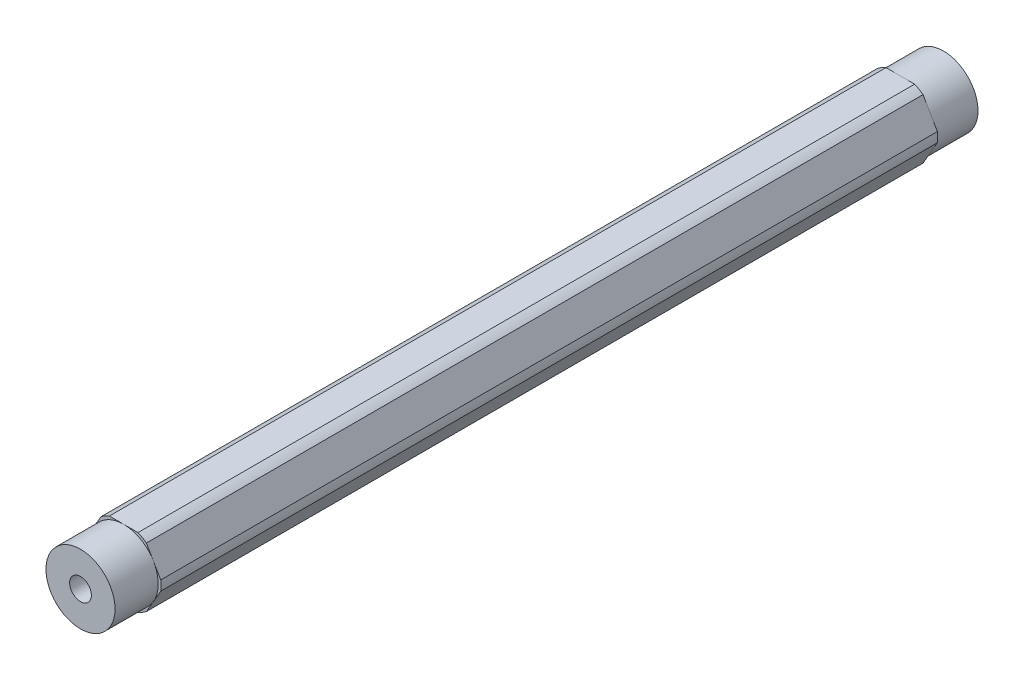
from build123d import *

# Parameters (mm, degrees)
SKETCH1_R           = 2.000000064
BOSS_EXTRUDE1_DEPTH = 71.4121
SKETCH4_R           = 6.35
SKETCH4_R_2         = 2.000000064
BOSS_EXTRUDE2_DEPTH = 7.9375


with BuildPart() as part:
    # Sketch1 → Boss-Extrude1 (new, symmetric)
    with BuildSketch(Plane.XY):
        with BuildLine():
            ThreePointArc((4.181770846, 5.456960429), (3.437499983, 5.953924622), (2.634980936, 6.35))
            Line((2.634980936, 6.35), (-2.634980936, 6.35))
            ThreePointArc((-2.634980936, 6.35), (-3.437499983, 5.953924622), (-4.181770846, 5.456960429))
            Line((-4.181770846, 5.456960429), (-6.816751782, 0.893039571))
            ThreePointArc((-6.816751782, 0.893039571), (-6.874999966, 0), (-6.816751782, -0.893039571))
            Line((-6.816751782, -0.893039571), (-4.181770846, -5.456960429))
            ThreePointArc((-4.181770846, -5.456960429), (-3.437499983, -5.953924622), (-2.634980936, -6.35))
            Line((-2.634980936, -6.35), (2.634980936, -6.35))
            ThreePointArc((2.634980936, -6.35), (3.437499983, -5.953924622), (4.181770846, -5.456960429))
            Line((4.181770846, -5.456960429), (6.816751782, -0.893039571))
            ThreePointArc((6.816751782, -0.893039571), (6.860422465, -0.447468582), (6.874999966, 0))
            ThreePointArc((6.874999966, 0), (6.860422465, 0.447468582), (6.816751782, 0.893039571))
            Line((6.816751782, 0.893039571), (4.181770846, 5.456960429))
        make_face()
        Circle(SKETCH1_R, mode=Mode.SUBTRACT)
    extrude(amount=BOSS_EXTRUDE1_DEPTH, both=True)

    # Sketch4 → Boss-Extrude2 (add)
    with BuildSketch(Plane.XY.offset(71.4121)):
        with Locations(Location((0, 0, 0), (0, 0, 150))):
            Circle(SKETCH4_R)
        Circle(SKETCH4_R_2, mode=Mode.SUBTRACT)
    boss_extrude2 = extrude(amount=BOSS_EXTRUDE2_DEPTH)

    # Mirror1: Boss-Extrude2 across plane
    add(boss_extrude2.mirror(Plane.XY))


solid = part.part
